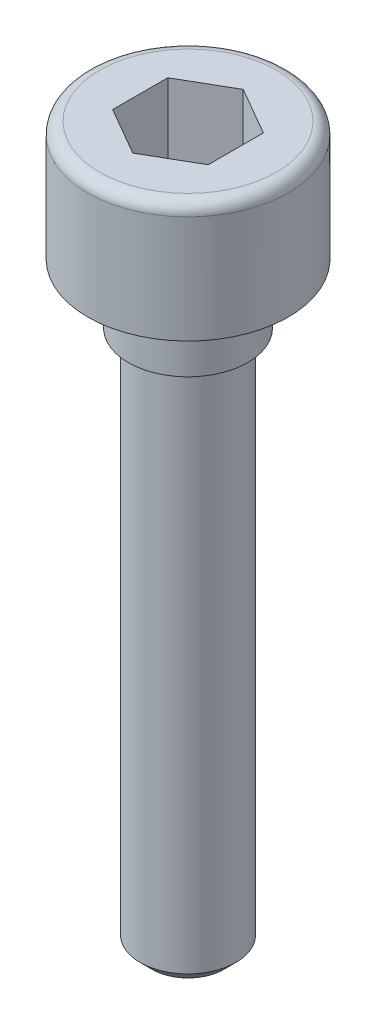
from build123d import *

# Parameters (mm, degrees)
CORTAR_EXTRUIR1_DEPTH = 3
CHAFL_N1_SIZE         = 0.5
REDONDEO1_R           = 0.5
CROQUIS3_W            = 0.5
CROQUIS3_H            = 22.5
CHAFL_N2_SIZE         = 0.5


with BuildPart() as part:
    # Croquis1 → Revolución1 (revolve)
    with BuildSketch(Plane.XY, mode=Mode.PRIVATE) as revoluci_n1_sk:
        Polygon((0, 0), (4.2, 0), (4.2, -5), (2.5, -5), (2.5, -30), (0, -30), align=None)
    revolve(revoluci_n1_sk.sketch.rotate(Axis((0, 0, 0), (0, -1, 0)), 90), axis=Axis((0, 0, 0), (0, -1, 0)))

    # Croquis2 → Cortar-Extruir1 (cut)
    with BuildSketch(Plane(origin=(0, 0, 0), x_dir=(1, 0, 0), z_dir=(0, 1, 0))):
        Polygon((2, 1.154700538), (0, 2.309401077), (-2, 1.154700538), (-2, -1.154700538), (0, -2.309401077), (2, -1.154700538), align=None)
    extrude(amount=-CORTAR_EXTRUIR1_DEPTH, mode=Mode.SUBTRACT)

    # Chaflán1
    chafl_n1_edges = [part.edges().sort_by_distance(p)[0] for p in [
        (0, -30, -2.5),
    ]]
    chamfer(chafl_n1_edges, length=CHAFL_N1_SIZE)

    # Redondeo1
    redondeo1_edges = [part.edges().sort_by_distance(p)[0] for p in [
        (0, 0, -4.2),
    ]]
    fillet(redondeo1_edges, radius=REDONDEO1_R)

    # Croquis3 → Cortar-Revolución1 (revolve, cut)
    with BuildSketch(Plane.XY, mode=Mode.PRIVATE) as cortar_revoluci_n1_sk:
        with Locations((2.25, -18.75)):
            Rectangle(CROQUIS3_W, CROQUIS3_H)
    revolve(cortar_revoluci_n1_sk.sketch.rotate(Axis((0, 0, 0), (0, -1, 0)), 90), axis=Axis((0, 0, 0), (0, -1, 0)), mode=Mode.SUBTRACT)

    # Chaflán2
    chafl_n2_edges = [part.edges().sort_by_distance(p)[0] for p in [
        (0, -30, -2),
    ]]
    chamfer(chafl_n2_edges, length=CHAFL_N2_SIZE)


solid = part.part
